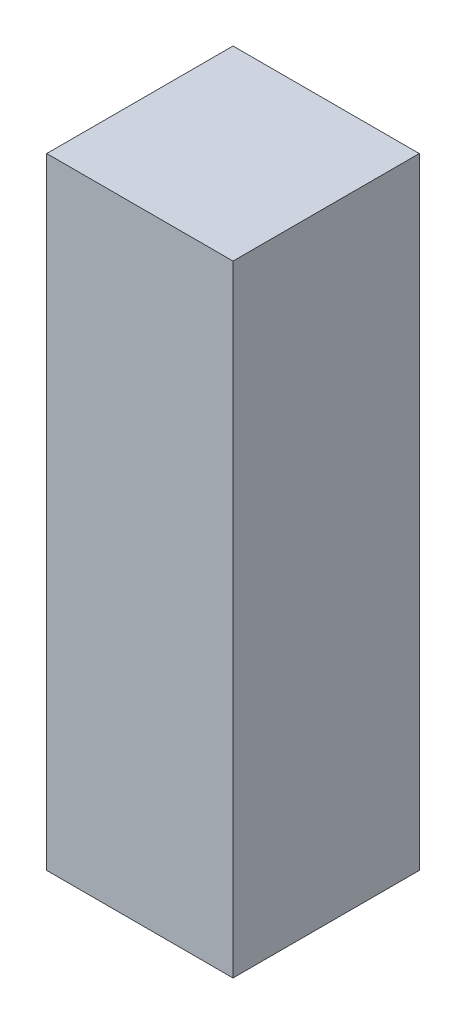
from build123d import *

# Parameters (mm, degrees)
UCY_KILIT_PIMI_12X40_1_START = -168
SKETCH1_W                    = 12
SKETCH1_H                    = 40
UCY_KILIT_PIMI_12X40_1_DEPTH = 12


with BuildPart() as part:
    # Sketch1 → UCY_kilit_pimi_12x40_1 (new body)
    with BuildSketch(Plane.XY.offset(UCY_KILIT_PIMI_12X40_1_START)):
        with Locations((0, 40)):
            Rectangle(SKETCH1_W, SKETCH1_H)
    extrude(amount=-UCY_KILIT_PIMI_12X40_1_DEPTH)


solid = part.part
